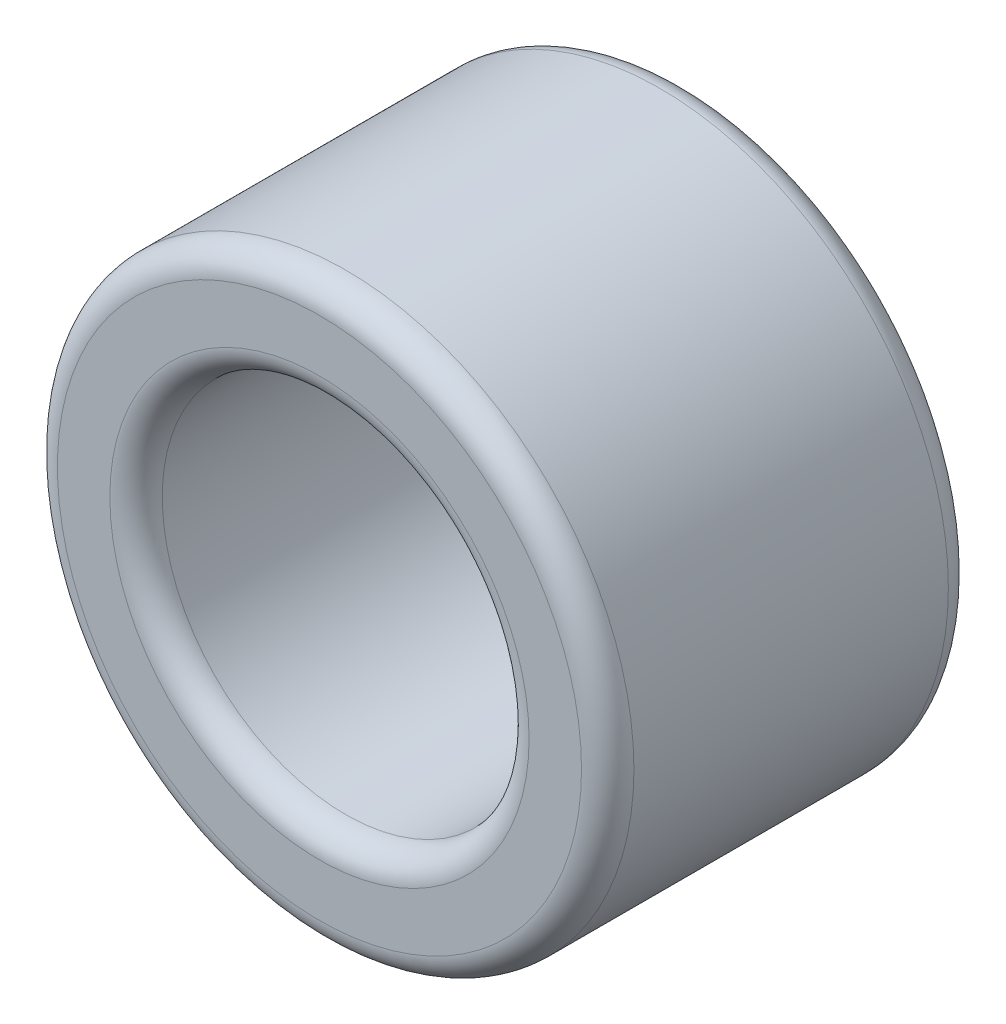
from build123d import *

# Parameters (mm, degrees)
SKETCH2_R           = 279.4
BOSS_EXTRUDE1_DEPTH = 355.6
SKETCH3_R           = 177.8
CUT_EXTRUDE1_DEPTH  = 532.582618226
FILLET3_R           = 25.4
FILLET4_R           = 25.4


with BuildPart() as part:
    # Sketch2 → Boss-Extrude1 (new body)
    with BuildSketch(Plane.XY):
        Circle(SKETCH2_R)
    extrude(amount=BOSS_EXTRUDE1_DEPTH)

    # Sketch3 → Cut-Extrude1 (cut, through all)
    with BuildSketch(Plane.XY.offset(355.6)):
        Circle(SKETCH3_R)
    extrude(amount=-CUT_EXTRUDE1_DEPTH, mode=Mode.SUBTRACT)

    # Fillet3
    fillet3_edges = [part.edges().sort_by_distance(p)[0] for p in [
        (-279.4, 0, 0),
        (-279.4, 0, 355.6),
    ]]
    fillet(fillet3_edges, radius=FILLET3_R)

    # Fillet4
    fillet4_edges = [part.edges().sort_by_distance(p)[0] for p in [
        (-177.8, 0, 0),
        (-177.8, 0, 355.6),
    ]]
    fillet(fillet4_edges, radius=FILLET4_R)


solid = part.part
